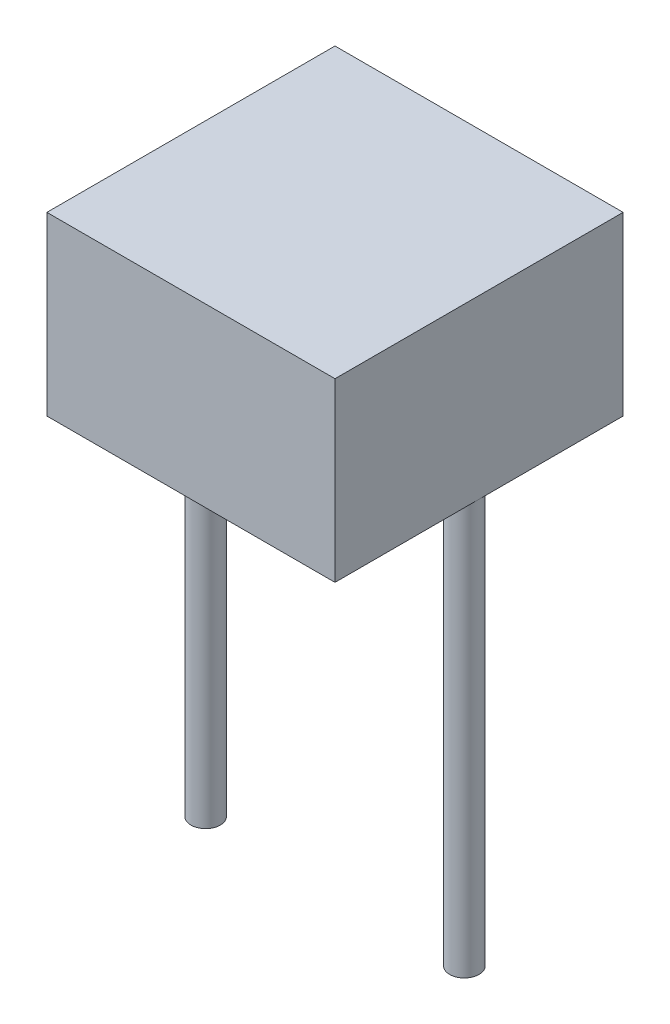
from build123d import *

# Parameters (mm, degrees)
SKETCH1_W           = 6.223
SKETCH1_H           = 6.223
BOSS_EXTRUDE1_DEPTH = 3.81
SKETCH2_R           = 0.3175
BOSS_EXTRUDE2_DEPTH = 8.89


with BuildPart() as part:
    # Sketch1 → Boss-Extrude1 (new body)
    with BuildSketch(Plane(origin=(0, 0, 0), x_dir=(1, 0, 0), z_dir=(0, 1, 0))):
        Rectangle(SKETCH1_W, SKETCH1_H)
    extrude(amount=BOSS_EXTRUDE1_DEPTH)

    # Sketch2 → Boss-Extrude2 (add)
    with BuildSketch(Plane.XZ):
        with Locations(Location((-2.794, 0, 0), (0, 0, 180))):
            Circle(SKETCH2_R)
        with Locations((2.794, 0)):
            Circle(SKETCH2_R)
    extrude(amount=BOSS_EXTRUDE2_DEPTH)


solid = part.part
